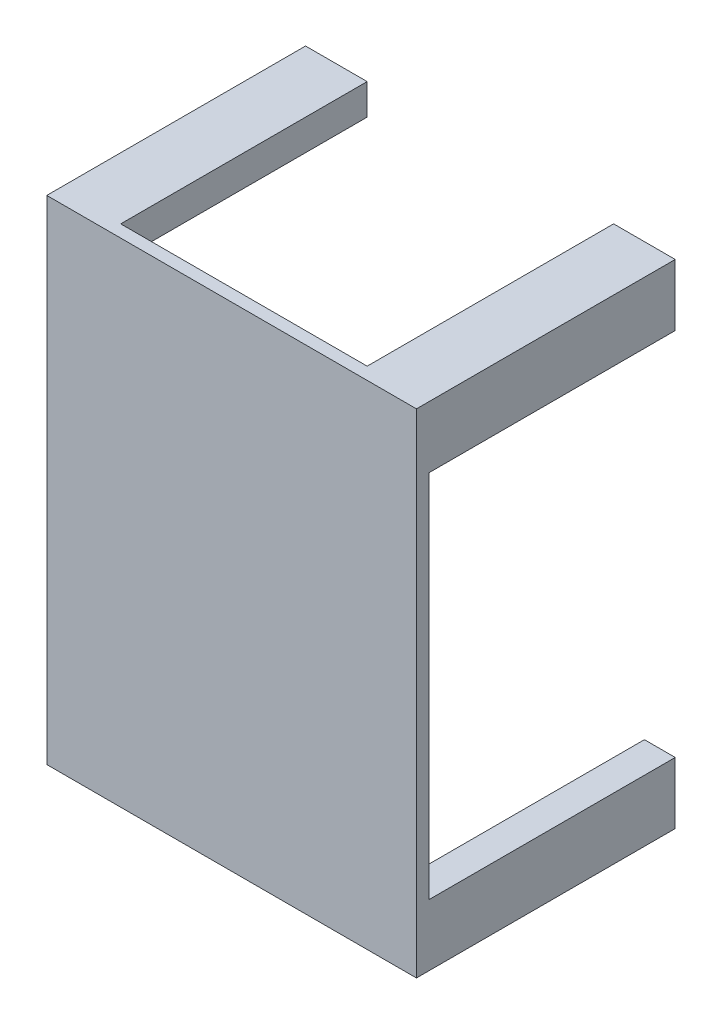
from build123d import *

# Parameters (mm, degrees)
ESQUISSE2_W        = 60
ESQUISSE2_H        = 80
BOSS_EXTRU_1_DEPTH = 2
BOSS_EXTRU_3_DEPTH = 40


with BuildPart() as part:
    # Esquisse2 → Boss.-Extru.1 (new body)
    with BuildSketch(Plane.XY):
        with Locations((30, 40)):
            Rectangle(ESQUISSE2_W, ESQUISSE2_H)
    extrude(amount=BOSS_EXTRU_1_DEPTH)

    # Esquisse3 → Boss.-Extru.3 (add)
    with BuildSketch(Plane(origin=(0, 0, 0), x_dir=(-1, 0, 0), z_dir=(0, 0, -1))):
        Polygon((-60, 0), (-50, 0), (-50, 5), (-55, 5), (-55, 10), (-60, 10), align=None)
        Polygon((0, 0), (-10, 0), (-10, 5), (-5, 5), (-5, 10), (0, 10), align=None)
        Polygon((0, 80), (-10, 80), (-10, 75), (-5, 75), (-5, 70), (0, 70), align=None)
        Polygon((-60, 80), (-50, 80), (-50, 75), (-55, 75), (-55, 70), (-60, 70), align=None)
    extrude(amount=BOSS_EXTRU_3_DEPTH)


solid = part.part
